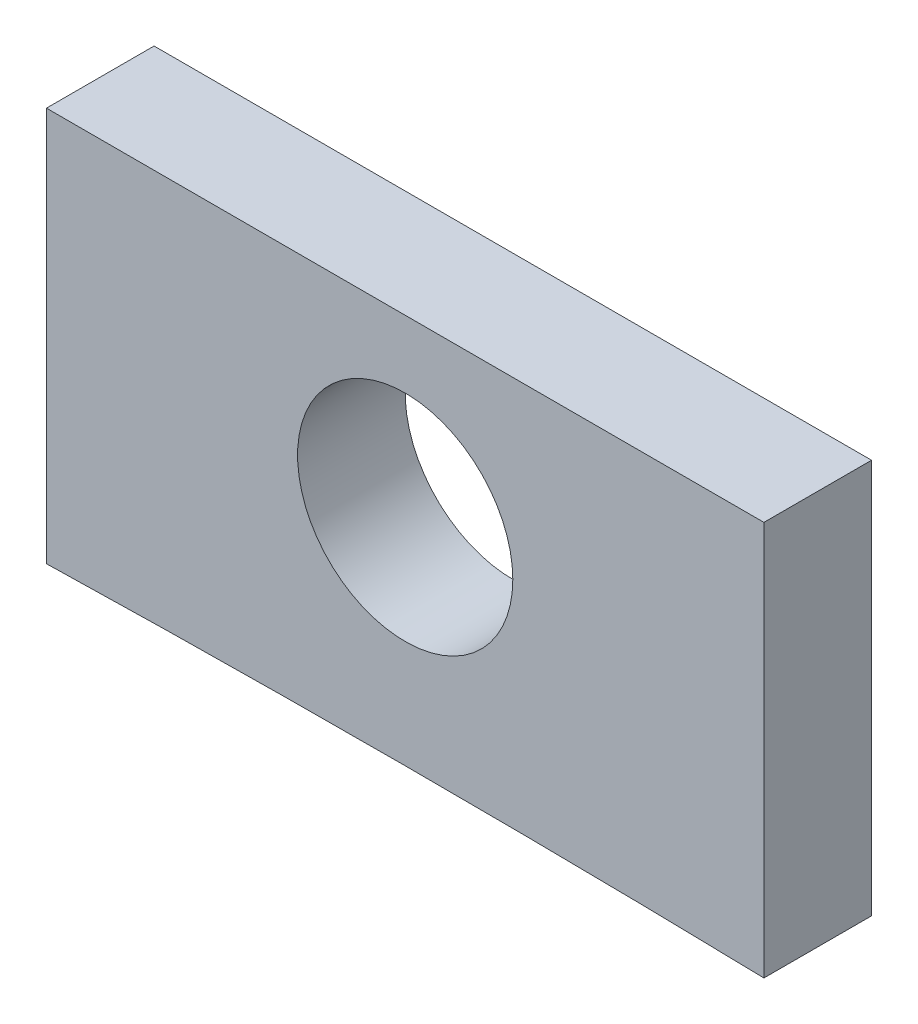
from build123d import *

# Parameters (mm, degrees)
SKETCH_1_R      = 3
EXTRUDE_1_DEPTH = 3


with BuildPart() as part:
    # Эскиз1 → Бобышка-Вытянуть1 (new body)
    with BuildSketch(Plane.XY):
        with BuildLine():
            Line((-10, 699.876828607), (10, 699.876828607))
            Line((10, 699.876828607), (10, 688.876828607))
            ThreePointArc((10, 688.876828607), (0, 689), (-10, 688.876828607))
            Line((-10, 688.876828607), (-10, 699.876828607))
        make_face()
        with Locations((0, 695)):
            Circle(SKETCH_1_R, mode=Mode.SUBTRACT)
    extrude(amount=EXTRUDE_1_DEPTH)


solid = part.part
